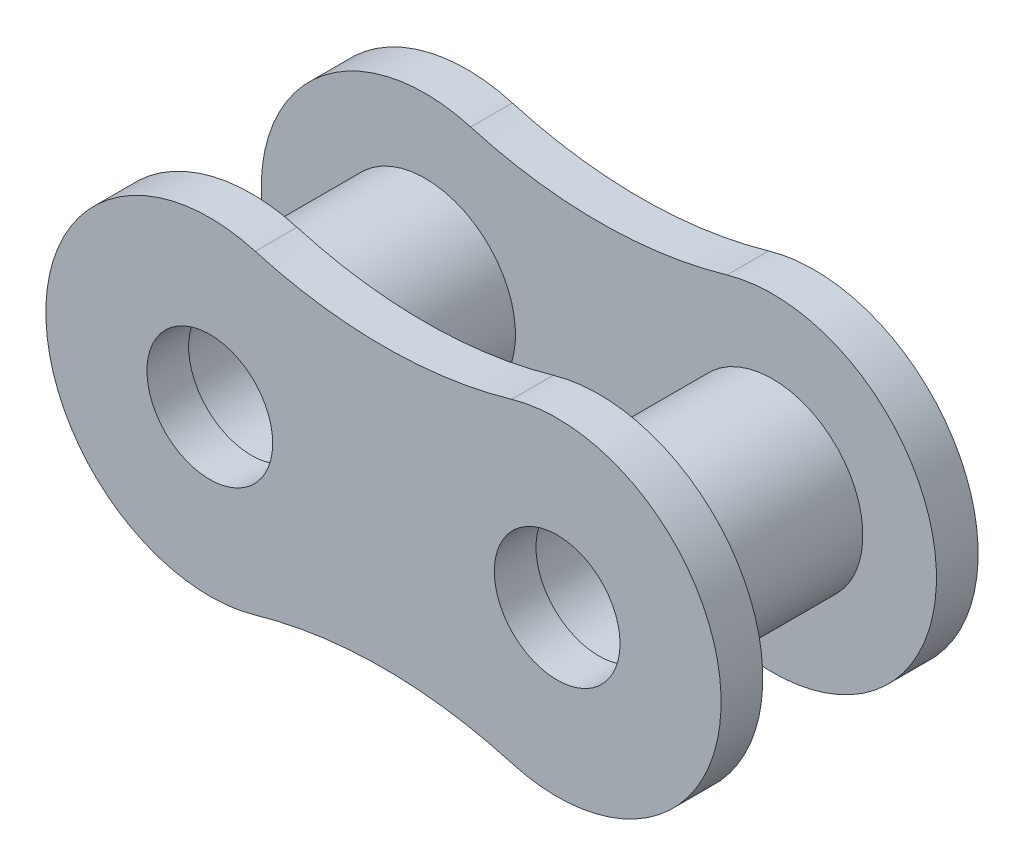
from build123d import *

# Parameters (mm, degrees)
SKETCH4_R             = 1.651
SKETCH4_R_2           = 1.17475
BOSS_EXTRUDE1_DEPTH   = 1.5875
BOSS_EXTRUDE1_2_DEPTH = 1.5875
SKETCH5_R             = 1.14935
BOSS_EXTRUDE2_DEPTH   = 0.762


with BuildPart() as part:
    # Sketch4 → Boss-Extrude1 (new, symmetric)
    with BuildSketch(Plane.XY):
        with Locations((-3.175, 0)):
            Circle(SKETCH4_R)
        with Locations((-3.175, 0)):
            Circle(SKETCH4_R_2, mode=Mode.SUBTRACT)
    extrude(amount=BOSS_EXTRUDE1_DEPTH, both=True)


with BuildPart() as body_2:
    # Sketch4 → Boss-Extrude1 2 (new, symmetric)
    with BuildSketch(Plane.XY):
        with Locations((3.175, 0)):
            Circle(SKETCH4_R)
        with Locations((3.175, 0)):
            Circle(SKETCH4_R_2, mode=Mode.SUBTRACT)
    extrude(amount=BOSS_EXTRUDE1_2_DEPTH, both=True)


with BuildPart() as body_3:
    # Sketch5 → Boss-Extrude2 (new body)
    with BuildSketch(Plane.XY.offset(1.5875)):
        with BuildLine():
            ThreePointArc((-2.342877482, 2.879371452), (-6.1722, 0), (-2.342877482, -2.879371452))
            ThreePointArc((-2.342877482, -2.879371452), (0, -2.54762), (2.342877482, -2.879371452))
            ThreePointArc((2.342877482, -2.879371452), (6.1722, 0), (2.342877482, 2.879371452))
            ThreePointArc((2.342877482, 2.879371452), (0, 2.54762), (-2.342877482, 2.879371452))
        make_face()
        with Locations((-3.175, 0)):
            Circle(SKETCH5_R, mode=Mode.SUBTRACT)
        with Locations((3.175, 0)):
            Circle(SKETCH5_R, mode=Mode.SUBTRACT)
    extrude(amount=BOSS_EXTRUDE2_DEPTH)


with BuildPart() as body_4:
    # Mirror3: mirrored copy
    add(body_3.part.mirror(Plane.XY))

    # Combine2: union body 3, body 2, part
    add(body_3.part)
    add(body_2.part)
    add(part.part)


solid = body_4.part
